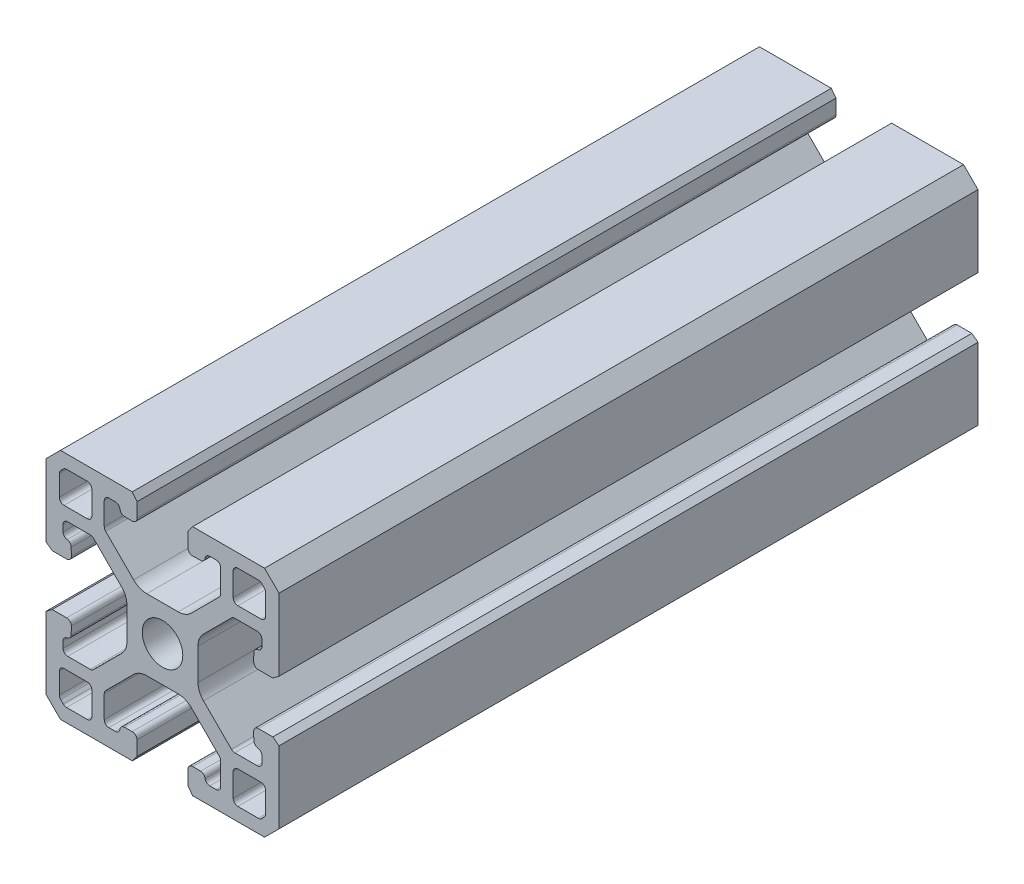
from build123d import *

# Parameters (mm, degrees)
SKETCH1_R           = 3.3147
BOSS_EXTRUDE1_DEPTH = 114.3


with BuildPart() as part:
    # Sketch1 → Boss-Extrude1 (new body)
    with BuildSketch(Plane(origin=(0, 0, 0), x_dir=(-1, 0, 0), z_dir=(0, 0, 1))):
        with BuildLine():
            Line((-19.05, 4.9276), (-19.05, 16.6878))
            Line((-19.05, 16.6878), (-16.6878, 19.05))
            Line((-16.6878, 19.05), (-4.9276, 19.05))
            Line((-4.9276, 19.05), (-4.1656, 18.044024186))
            Line((-4.1656, 18.044024186), (-4.1656, 15.669241304))
            ThreePointArc((-4.1656, 15.669241304), (-4.393507141, 15.125744462), (-4.940898734, 14.90735736))
            Line((-4.940898734, 14.90735736), (-6.223767748, 14.929749922))
            ThreePointArc((-6.223767748, 14.929749922), (-6.718113097, 15.123354458), (-6.966034507, 15.592816933))
            ThreePointArc((-6.966034507, 15.592816933), (-7.218934357, 16.066687743), (-7.7216, 16.256))
            Line((-7.7216, 16.256), (-8.763, 16.256))
            ThreePointArc((-8.763, 16.256), (-9.301815367, 16.032815367), (-9.525, 15.494))
            Line((-9.525, 15.494), (-9.525, 11.816287081))
            ThreePointArc((-9.525, 11.816287081), (-9.466996204, 11.524682306), (-9.301815367, 11.277471714))
            Line((-9.301815367, 11.277471714), (-4.7244731, 6.700129446))
            ThreePointArc((-4.7244731, 6.700129446), (-3.735630732, 6.0394061), (-2.569211631, 5.807390915))
            Line((-2.569211631, 5.807390915), (2.569211631, 5.807390915))
            ThreePointArc((2.569211631, 5.807390915), (3.735630732, 6.0394061), (4.7244731, 6.700129446))
            Line((4.7244731, 6.700129446), (9.301815367, 11.277471714))
            ThreePointArc((9.301815367, 11.277471714), (9.466996204, 11.524682306), (9.525, 11.816287081))
            Line((9.525, 11.816287081), (9.525, 15.494))
            ThreePointArc((9.525, 15.494), (9.301815367, 16.032815367), (8.763, 16.256))
            Line((8.763, 16.256), (7.7216, 16.256))
            ThreePointArc((7.7216, 16.256), (7.218934357, 16.066687743), (6.966034507, 15.592816933))
            ThreePointArc((6.966034507, 15.592816933), (6.718113097, 15.123354458), (6.223767748, 14.929749922))
            Line((6.223767748, 14.929749922), (4.940898734, 14.90735736))
            ThreePointArc((4.940898734, 14.90735736), (4.393507141, 15.125744462), (4.1656, 15.669241304))
            Line((4.1656, 15.669241304), (4.1656, 18.044024186))
            Line((4.1656, 18.044024186), (4.9276, 19.05))
            Line((4.9276, 19.05), (16.6878, 19.05))
            Line((16.6878, 19.05), (19.05, 16.6878))
            Line((19.05, 16.6878), (19.05, 4.9276))
            Line((19.05, 4.9276), (18.044024186, 4.1656))
            Line((18.044024186, 4.1656), (15.669241304, 4.1656))
            ThreePointArc((15.669241304, 4.1656), (15.125744462, 4.393507141), (14.90735736, 4.940898734))
            Line((14.90735736, 4.940898734), (14.929749922, 6.223767748))
            ThreePointArc((14.929749922, 6.223767748), (15.123354458, 6.718113097), (15.592816933, 6.966034507))
            ThreePointArc((15.592816933, 6.966034507), (16.066687743, 7.218934357), (16.256, 7.7216))
            Line((16.256, 7.7216), (16.256, 8.763))
            ThreePointArc((16.256, 8.763), (16.032815367, 9.301815367), (15.494, 9.525))
            Line((15.494, 9.525), (11.816287081, 9.525))
            ThreePointArc((11.816287081, 9.525), (11.524682306, 9.466996204), (11.277471714, 9.301815367))
            Line((11.277471714, 9.301815367), (6.700129446, 4.7244731))
            ThreePointArc((6.700129446, 4.7244731), (6.0394061, 3.735630732), (5.807390915, 2.569211631))
            Line((5.807390915, 2.569211631), (5.807390915, -2.569211631))
            ThreePointArc((5.807390915, -2.569211631), (6.0394061, -3.735630732), (6.700129446, -4.7244731))
            Line((6.700129446, -4.7244731), (11.277471714, -9.301815367))
            ThreePointArc((11.277471714, -9.301815367), (11.524682306, -9.466996204), (11.816287081, -9.525))
            Line((11.816287081, -9.525), (15.494, -9.525))
            ThreePointArc((15.494, -9.525), (16.032815367, -9.301815367), (16.256, -8.763))
            Line((16.256, -8.763), (16.256, -7.7216))
            ThreePointArc((16.256, -7.7216), (16.066687743, -7.218934357), (15.592816933, -6.966034507))
            ThreePointArc((15.592816933, -6.966034507), (15.123354458, -6.718113097), (14.929749922, -6.223767748))
            Line((14.929749922, -6.223767748), (14.90735736, -4.940898734))
            ThreePointArc((14.90735736, -4.940898734), (15.125744462, -4.393507141), (15.669241304, -4.1656))
            Line((15.669241304, -4.1656), (18.044024186, -4.1656))
            Line((18.044024186, -4.1656), (19.05, -4.9276))
            Line((19.05, -4.9276), (19.05, -16.6878))
            Line((19.05, -16.6878), (16.6878, -19.05))
            Line((16.6878, -19.05), (4.940898734, -19.05))
            Line((4.940898734, -19.05), (4.1656, -18.044024186))
            Line((4.1656, -18.044024186), (4.1656, -15.669241304))
            ThreePointArc((4.1656, -15.669241304), (4.393507141, -15.125744462), (4.940898734, -14.90735736))
            Line((4.940898734, -14.90735736), (6.223767748, -14.929749922))
            ThreePointArc((6.223767748, -14.929749922), (6.718113097, -15.123354458), (6.966034507, -15.592816933))
            ThreePointArc((6.966034507, -15.592816933), (7.218934357, -16.066687743), (7.7216, -16.256))
            Line((7.7216, -16.256), (8.763, -16.256))
            ThreePointArc((8.763, -16.256), (9.301815367, -16.032815367), (9.525, -15.494))
            Line((9.525, -15.494), (9.525, -11.816287081))
            ThreePointArc((9.525, -11.816287081), (9.466996204, -11.524682306), (9.301815367, -11.277471714))
            Line((9.301815367, -11.277471714), (4.7244731, -6.700129446))
            ThreePointArc((4.7244731, -6.700129446), (3.735630732, -6.0394061), (2.569211631, -5.807390915))
            Line((2.569211631, -5.807390915), (-2.569211631, -5.807390915))
            ThreePointArc((-2.569211631, -5.807390915), (-3.735630732, -6.0394061), (-4.7244731, -6.700129446))
            Line((-4.7244731, -6.700129446), (-9.301815367, -11.277471714))
            ThreePointArc((-9.301815367, -11.277471714), (-9.466996204, -11.524682306), (-9.525, -11.816287081))
            Line((-9.525, -11.816287081), (-9.525, -15.494))
            ThreePointArc((-9.525, -15.494), (-9.301815367, -16.032815367), (-8.763, -16.256))
            Line((-8.763, -16.256), (-7.7216, -16.256))
            ThreePointArc((-7.7216, -16.256), (-7.218934357, -16.066687743), (-6.966034507, -15.592816933))
            ThreePointArc((-6.966034507, -15.592816933), (-6.718113097, -15.123354458), (-6.223767748, -14.929749922))
            Line((-6.223767748, -14.929749922), (-4.940898734, -14.90735736))
            ThreePointArc((-4.940898734, -14.90735736), (-4.393507141, -15.125744462), (-4.1656, -15.669241304))
            Line((-4.1656, -15.669241304), (-4.1656, -18.044024186))
            Line((-4.1656, -18.044024186), (-4.9276, -19.05))
            Line((-4.9276, -19.05), (-16.6878, -19.05))
            Line((-16.6878, -19.05), (-19.05, -16.6878))
            Line((-19.05, -16.6878), (-19.05, -4.9276))
            Line((-19.05, -4.9276), (-18.044024186, -4.1656))
            Line((-18.044024186, -4.1656), (-15.669241304, -4.1656))
            ThreePointArc((-15.669241304, -4.1656), (-15.125744462, -4.393507141), (-14.90735736, -4.940898734))
            Line((-14.90735736, -4.940898734), (-14.929749922, -6.223767748))
            ThreePointArc((-14.929749922, -6.223767748), (-15.123354458, -6.718113097), (-15.592816933, -6.966034507))
            ThreePointArc((-15.592816933, -6.966034507), (-16.066687743, -7.218934357), (-16.256, -7.7216))
            Line((-16.256, -7.7216), (-16.256, -8.763))
            ThreePointArc((-16.256, -8.763), (-16.032815367, -9.301815367), (-15.494, -9.525))
            Line((-15.494, -9.525), (-11.816287081, -9.525))
            ThreePointArc((-11.816287081, -9.525), (-11.524682306, -9.466996204), (-11.277471714, -9.301815367))
            Line((-11.277471714, -9.301815367), (-6.700129446, -4.7244731))
            ThreePointArc((-6.700129446, -4.7244731), (-6.0394061, -3.735630732), (-5.807390915, -2.569211631))
            Line((-5.807390915, -2.569211631), (-5.807390915, 2.569211631))
            ThreePointArc((-5.807390915, 2.569211631), (-6.0394061, 3.735630732), (-6.700129446, 4.7244731))
            Line((-6.700129446, 4.7244731), (-11.277471714, 9.301815367))
            ThreePointArc((-11.277471714, 9.301815367), (-11.524682306, 9.466996204), (-11.816287081, 9.525))
            Line((-11.816287081, 9.525), (-15.494, 9.525))
            ThreePointArc((-15.494, 9.525), (-16.032815367, 9.301815367), (-16.256, 8.763))
            Line((-16.256, 8.763), (-16.256, 7.7216))
            ThreePointArc((-16.256, 7.7216), (-16.066687743, 7.218934357), (-15.592816933, 6.966034507))
            ThreePointArc((-15.592816933, 6.966034507), (-15.123354458, 6.718113097), (-14.929749922, 6.223767748))
            Line((-14.929749922, 6.223767748), (-14.90735736, 4.940898734))
            ThreePointArc((-14.90735736, 4.940898734), (-15.125744462, 4.393507141), (-15.669241304, 4.1656))
            Line((-15.669241304, 4.1656), (-18.044024186, 4.1656))
            Line((-18.044024186, 4.1656), (-19.05, 4.9276))
        make_face()
        with Locations(Location((0, 0, 0), (0, 0, 180))):
            Circle(SKETCH1_R, mode=Mode.SUBTRACT)
        with BuildLine():
            Line((-16.8656, 12.319), (-16.8656, 15.682887307))
            ThreePointArc((-16.8656, 15.682887307), (-16.807596204, 15.974492082), (-16.642415367, 16.221702674))
            Line((-16.642415367, 16.221702674), (-16.221702674, 16.642415367))
            ThreePointArc((-16.221702674, 16.642415367), (-15.974492082, 16.807596204), (-15.682887307, 16.8656))
            Line((-15.682887307, 16.8656), (-12.319, 16.8656))
            ThreePointArc((-12.319, 16.8656), (-11.780184633, 16.642415367), (-11.557, 16.1036))
            Line((-11.557, 16.1036), (-11.557, 12.319))
            ThreePointArc((-11.557, 12.319), (-11.780184633, 11.780184633), (-12.319, 11.557))
            Line((-12.319, 11.557), (-16.1036, 11.557))
            ThreePointArc((-16.1036, 11.557), (-16.642415367, 11.780184633), (-16.8656, 12.319))
        make_face(mode=Mode.SUBTRACT)
        with BuildLine():
            Line((-16.1036, -11.557), (-12.319, -11.557))
            ThreePointArc((-12.319, -11.557), (-11.780184633, -11.780184633), (-11.557, -12.319))
            Line((-11.557, -12.319), (-11.557, -16.1036))
            ThreePointArc((-11.557, -16.1036), (-11.780184633, -16.642415367), (-12.319, -16.8656))
            Line((-12.319, -16.8656), (-15.682887307, -16.8656))
            ThreePointArc((-15.682887307, -16.8656), (-15.974492082, -16.807596204), (-16.221702674, -16.642415367))
            Line((-16.221702674, -16.642415367), (-16.642415367, -16.221702674))
            ThreePointArc((-16.642415367, -16.221702674), (-16.807596204, -15.974492082), (-16.8656, -15.682887307))
            Line((-16.8656, -15.682887307), (-16.8656, -12.319))
            ThreePointArc((-16.8656, -12.319), (-16.642415367, -11.780184633), (-16.1036, -11.557))
        make_face(mode=Mode.SUBTRACT)
        with BuildLine():
            Line((15.682887307, -16.8656), (12.319, -16.8656))
            ThreePointArc((12.319, -16.8656), (11.780184633, -16.642415367), (11.557, -16.1036))
            Line((11.557, -16.1036), (11.557, -12.319))
            ThreePointArc((11.557, -12.319), (11.780184633, -11.780184633), (12.319, -11.557))
            Line((12.319, -11.557), (16.1036, -11.557))
            ThreePointArc((16.1036, -11.557), (16.642415367, -11.780184633), (16.8656, -12.319))
            Line((16.8656, -12.319), (16.8656, -15.682887307))
            ThreePointArc((16.8656, -15.682887307), (16.807596204, -15.974492082), (16.642415367, -16.221702674))
            Line((16.642415367, -16.221702674), (16.221702674, -16.642415367))
            ThreePointArc((16.221702674, -16.642415367), (15.974492082, -16.807596204), (15.682887307, -16.8656))
        make_face(mode=Mode.SUBTRACT)
        with BuildLine():
            Line((11.557, 12.319), (11.557, 16.1036))
            ThreePointArc((11.557, 16.1036), (11.780184633, 16.642415367), (12.319, 16.8656))
            Line((12.319, 16.8656), (15.682887307, 16.8656))
            ThreePointArc((15.682887307, 16.8656), (15.974492082, 16.807596204), (16.221702674, 16.642415367))
            Line((16.221702674, 16.642415367), (16.642415367, 16.221702674))
            ThreePointArc((16.642415367, 16.221702674), (16.807596204, 15.974492082), (16.8656, 15.682887307))
            Line((16.8656, 15.682887307), (16.8656, 12.319))
            ThreePointArc((16.8656, 12.319), (16.642415367, 11.780184633), (16.1036, 11.557))
            Line((16.1036, 11.557), (12.319, 11.557))
            ThreePointArc((12.319, 11.557), (11.780184633, 11.780184633), (11.557, 12.319))
        make_face(mode=Mode.SUBTRACT)
    extrude(amount=BOSS_EXTRUDE1_DEPTH)


solid = part.part
